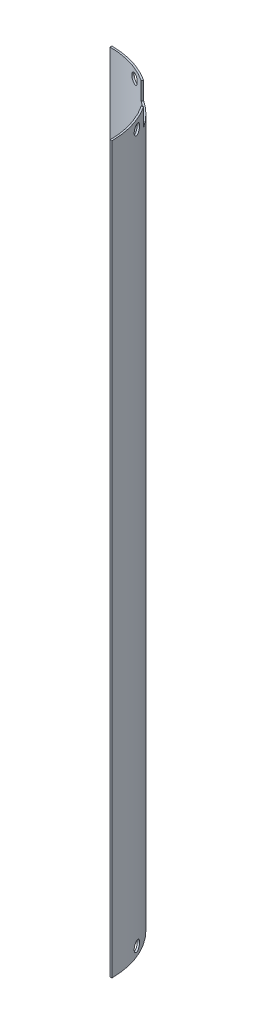
from build123d import *

# Parameters (mm, degrees)
BOSS_EXTRUDE1_DEPTH     = 812
CUT_EXTRUDE2_REACH      = 820.409
CUT_EXTRUDE2_END_RADIUS = 90
SKETCH3_R               = 5.565
CUT_EXTRUDE3_REACH      = 820.409
CUT_EXTRUDE3_END_RADIUS = 90
SKETCH5_R               = 5.565
LPATTERN2_COUNT         = 2
LPATTERN2_PITCH         = 792
CUT_EXTRUDE5_DEPTH      = 20
BODY_MOVE_COPY1_ANGLE   = 180


with BuildPart() as part:
    # Sketch1 → Boss-Extrude1 (new body)
    with BuildSketch(Plane(origin=(0, 0, 0), x_dir=(1, 0, 0), z_dir=(0, 1, 0))):
        with BuildLine():
            Line((0, 92), (0, 90))
            ThreePointArc((0, 90), (63.639610307, 63.639610307), (90, 0))
            Line((90, 0), (92, 0))
            ThreePointArc((92, 0), (65.053823869, 65.053823869), (0, 92))
        make_face()
    extrude(amount=BOSS_EXTRUDE1_DEPTH)

    # Cut-Extrude2: up to this cylinder (the profile starts outside it)
    cut_extrude2_end = Plane(origin=(0, 10, 0), z_dir=(0, -1, 0)) * Cylinder(CUT_EXTRUDE2_END_RADIUS, 1821.818, mode=Mode.PRIVATE)
    # Sketch3 → Cut-Extrude2 (cut, up to the surface)
    with BuildSketch(Plane(origin=(84.996916991, 0, -35.206875778), x_dir=(-0.38268343236509045, 0, -0.9238795325112865), z_dir=(0.9238795325112865, 0, -0.38268343236509045)), mode=Mode.PRIVATE) as cut_extrude2_sk1:
        with Locations((0, 10)):
            Circle(SKETCH3_R)
    cut_extrude2_tool1 = extrude(cut_extrude2_sk1.sketch, amount=-CUT_EXTRUDE2_REACH, mode=Mode.PRIVATE) - cut_extrude2_end
    cut_extrude2 = cut_extrude2_tool1.solids().sort_by_distance((84.996917, 10, -35.206876))[0]
    add(cut_extrude2, mode=Mode.SUBTRACT)

    # Cut-Extrude3: up to this cylinder (the profile starts outside it)
    cut_extrude3_end = Plane(origin=(0, 10, 0), z_dir=(0, -1, 0)) * Cylinder(CUT_EXTRUDE3_END_RADIUS, 1821.818, mode=Mode.PRIVATE)
    # Sketch5 → Cut-Extrude3 (cut, up to the surface)
    with BuildSketch(Plane(origin=(35.206875778, 0, -84.996916991), x_dir=(-0.9238795325112878, 0, -0.3826834323650876), z_dir=(0.3826834323650876, 0, -0.9238795325112878)), mode=Mode.PRIVATE) as cut_extrude3_sk1:
        with Locations((0, 10)):
            Circle(SKETCH5_R)
    cut_extrude3_tool1 = extrude(cut_extrude3_sk1.sketch, amount=-CUT_EXTRUDE3_REACH, mode=Mode.PRIVATE) - cut_extrude3_end
    cut_extrude3 = cut_extrude3_tool1.solids().sort_by_distance((35.206876, 10, -84.996917))[0]
    add(cut_extrude3, mode=Mode.SUBTRACT)

    # LPattern2: Cut-Extrude2, Cut-Extrude3 ×2
    with Locations(*[(0, i * LPATTERN2_PITCH, 0) for i in range(1, LPATTERN2_COUNT)]):
        add(cut_extrude2, mode=Mode.SUBTRACT)
        add(cut_extrude3, mode=Mode.SUBTRACT)

    # Sketch7 → Cut-Extrude5 (cut)
    with BuildSketch(Plane.XZ):
        with BuildLine():
            Line((76.447375943, -51.183969281), (74.784435976, -50.072828318))
            ThreePointArc((74.784435976, -50.072828318), (63.639610307, -63.639610307), (50.072828318, -74.784435976))
            Line((50.072828318, -74.784435976), (51.183969281, -76.447375943))
            ThreePointArc((51.183969281, -76.447375943), (65.053823869, -65.053823869), (76.447375943, -51.183969281))
        make_face()
    extrude(amount=-CUT_EXTRUDE5_DEPTH, mode=Mode.SUBTRACT)


with BuildPart() as part_1:
    # Body-Move/Copy1: moved
    add(part.part.moved(Location((0, 0, 0))).rotate(Axis((0, 252, 0), (0.7071067811865488, -4.937700262164522e-15, -0.7071067811865462)), BODY_MOVE_COPY1_ANGLE))


solid = part_1.part
